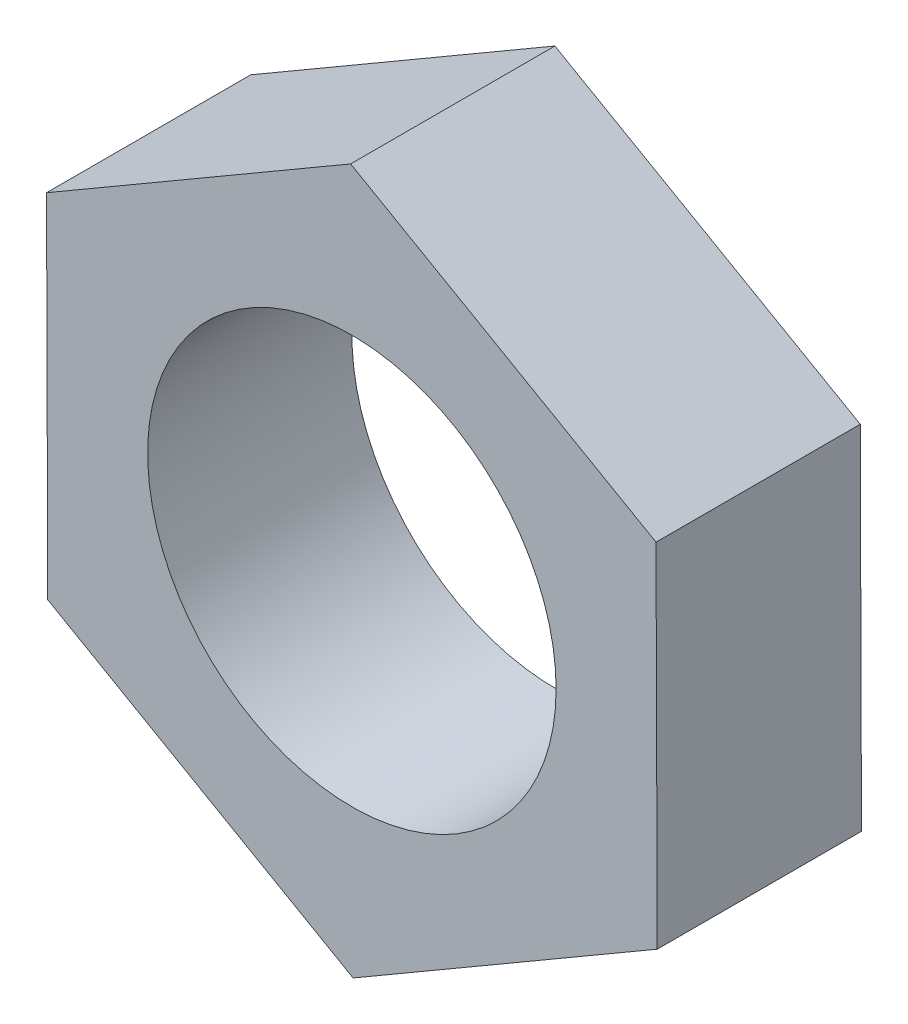
from build123d import *

# Parameters (mm, degrees)
SKETCH1_R           = 1.25
BOSS_EXTRUDE1_DEPTH = 1.25
SCALE1_SCALE        = 1.5


with BuildPart() as part:
    # Sketch1 → Boss-Extrude1 (new body)
    with BuildSketch(Plane.XY):
        Polygon((1.868889761, -1.070364136), (1.861407413, 1.083323942), (-0.007482348, 2.153688078), (-1.868889761, 1.070364136), (-1.861407413, -1.083323942), (0.007482348, -2.153688078), align=None)
        Circle(SKETCH1_R, mode=Mode.SUBTRACT)
    extrude(amount=BOSS_EXTRUDE1_DEPTH)


with BuildPart() as part_1:
    # Scale1: scaled about (0, 0, 0.625)
    add(part.part.scale(SCALE1_SCALE).moved(Location((0, 0, -0.3125))))


solid = part_1.part
